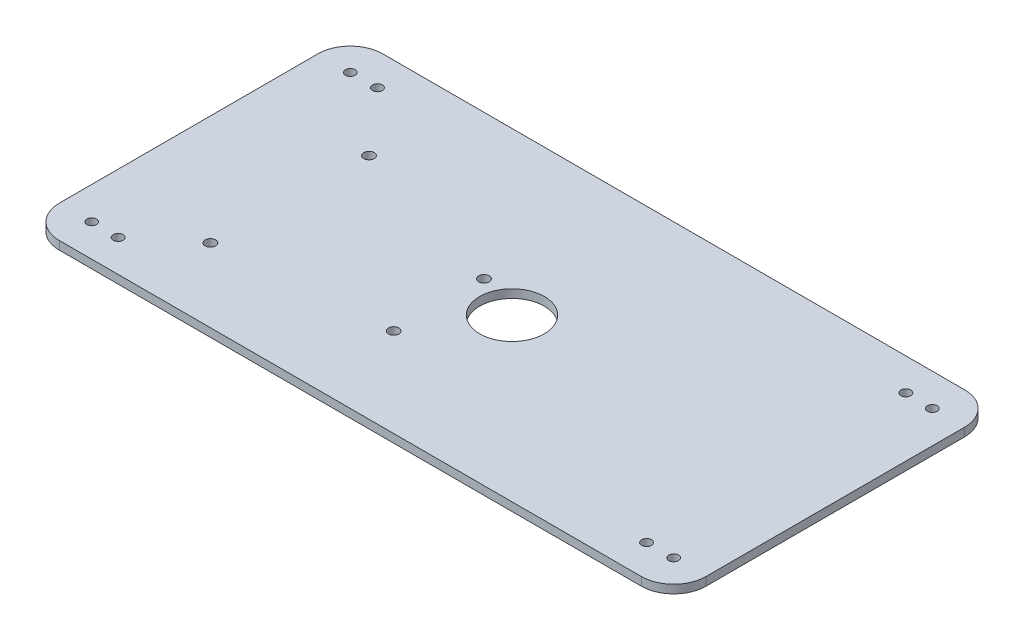
from build123d import *

# Parameters (mm, degrees)
SKETCH1_W               = 200
SKETCH1_H               = 100
BOSS_EXTRUDE1_DEPTH     = 2.6
FILLET1_R               = 10
SKETCH6_R               = 1.5
CUT_EXTRUDE6_DEPTH      = 2.6
MIRROR6_COPY_1_SKETCH_R = 1.5
MIRROR6_COPY_1_DEPTH    = 2.6
SKETCH16_R              = 1.61925
CUT_EXTRUDE9_DEPTH      = 10
SKETCH17_R              = 1.61925
CUT_EXTRUDE10_DEPTH     = 224.621913059
SKETCH18_R              = 1.61925
CUT_EXTRUDE11_DEPTH     = 224.621913059
SKETCH19_R              = 1.61925
CUT_EXTRUDE12_DEPTH     = 224.621913059
SKETCH15_R              = 10
CUT_EXTRUDE14_DEPTH     = 224.621913059
SKETCH23_R              = 1.524
CUT_EXTRUDE15_DEPTH     = 2.59999988
MIRROR8_COPY_1_SKETCH_R = 1.524
MIRROR8_COPY_1_DEPTH    = 2.59999988


with BuildPart() as part:
    # Sketch1 → Boss-Extrude1 (new body)
    with BuildSketch(Plane(origin=(0, 0, 0), x_dir=(1, 0, 0), z_dir=(0, 1, 0))):
        with Locations((100, -50)):
            Rectangle(SKETCH1_W, SKETCH1_H)
    extrude(amount=BOSS_EXTRUDE1_DEPTH)

    # Fillet1
    fillet1_edges = [part.edges().sort_by_distance(p)[0] for p in [
        (0, 1.3, 0),
        (200, 1.3, 0),
        (200, 1.3, 100),
        (0, 1.3, 100),
    ]]
    fillet(fillet1_edges, radius=FILLET1_R)

    # Sketch6 → Cut-Extrude6 (cut)
    with BuildSketch(Plane.XZ):
        with Locations(Location((190, 10, 0), (0, 0, 270))):
            Circle(SKETCH6_R)
    cut_extrude6 = extrude(amount=-CUT_EXTRUDE6_DEPTH, mode=Mode.SUBTRACT)

    # Mirror5: Cut-Extrude6 across plane
    add(cut_extrude6.mirror(Plane(origin=(100, 0, 0), x_dir=(0, 0, 1), z_dir=(1, 0, 0))), mode=Mode.SUBTRACT)

    # Mirror6: Cut-Extrude6 across plane
    add(cut_extrude6.mirror(Plane.XY.offset(50)), mode=Mode.SUBTRACT)

    # Mirror6 copy 1 sketch → Mirror6 copy 1 (cut)
    with BuildSketch(Plane(origin=(200, 0, 100), x_dir=(-1, 0, 0), z_dir=(0, -1, 0))):
        with Locations(Location((190, 10, 0), (0, 0, 270))):
            Circle(MIRROR6_COPY_1_SKETCH_R)
    extrude(amount=-MIRROR6_COPY_1_DEPTH, mode=Mode.SUBTRACT)

    # Sketch16 → Cut-Extrude9 (cut)
    with BuildSketch(Plane(origin=(0, 2.6, 0), x_dir=(1, 0, 0), z_dir=(0, 1, 0))):
        with Locations(Location((35.15745, -29.37145, 0), (0, 0, 270))):
            Circle(SKETCH16_R)
    extrude(amount=-CUT_EXTRUDE9_DEPTH, mode=Mode.SUBTRACT)

    # Sketch17 → Cut-Extrude10 (cut, through all)
    with BuildSketch(Plane(origin=(0, 2.6, 0), x_dir=(1, 0, 0), z_dir=(0, 1, 0))):
        with Locations(Location((85.94475, -44.61145, 0), (0, 0, 270))):
            Circle(SKETCH17_R)
    extrude(amount=-CUT_EXTRUDE10_DEPTH, mode=Mode.SUBTRACT)

    # Sketch18 → Cut-Extrude11 (cut, through all)
    with BuildSketch(Plane(origin=(0, 2.6, 0), x_dir=(1, 0, 0), z_dir=(0, 1, 0))):
        with Locations(Location((34.01445, -77.28855, 0), (0, 0, 270))):
            Circle(SKETCH18_R)
    extrude(amount=-CUT_EXTRUDE11_DEPTH, mode=Mode.SUBTRACT)

    # Sketch19 → Cut-Extrude12 (cut, through all)
    with BuildSketch(Plane(origin=(0, 2.6, 0), x_dir=(1, 0, 0), z_dir=(0, 1, 0))):
        with Locations(Location((85.94475, -72.53875, 0), (0, 0, 270))):
            Circle(SKETCH19_R)
    extrude(amount=-CUT_EXTRUDE12_DEPTH, mode=Mode.SUBTRACT)

    # Sketch15 → Cut-Extrude14 (cut, through all)
    with BuildSketch(Plane.XZ):
        with Locations(Location((100, 50, 0), (0, 0, 270))):
            Circle(SKETCH15_R)
    extrude(amount=-CUT_EXTRUDE14_DEPTH, mode=Mode.SUBTRACT)

    # Sketch23 → Cut-Extrude15 (cut)
    with BuildSketch(Plane(origin=(0, 2.6, 0), x_dir=(1, 0, 0), z_dir=(0, 1, 0))):
        with Locations(Location((18.288, -9.906, 0), (0, 0, 270))):
            Circle(SKETCH23_R)
    cut_extrude15 = extrude(amount=-CUT_EXTRUDE15_DEPTH, mode=Mode.SUBTRACT)

    # Mirror7: Cut-Extrude15 across plane
    add(cut_extrude15.mirror(Plane(origin=(100, 0, 0), x_dir=(0, 0, 1), z_dir=(1, 0, 0))), mode=Mode.SUBTRACT)

    # Mirror8: Cut-Extrude15 across plane
    add(cut_extrude15.mirror(Plane.XY.offset(50)), mode=Mode.SUBTRACT)

    # Mirror8 copy 1 sketch → Mirror8 copy 1 (cut)
    with BuildSketch(Plane(origin=(200, 2.6, 100), x_dir=(-1, 0, 0), z_dir=(0, 1, 0))):
        with Locations(Location((18.288, -9.906, 0), (0, 0, 270))):
            Circle(MIRROR8_COPY_1_SKETCH_R)
    extrude(amount=-MIRROR8_COPY_1_DEPTH, mode=Mode.SUBTRACT)


solid = part.part
